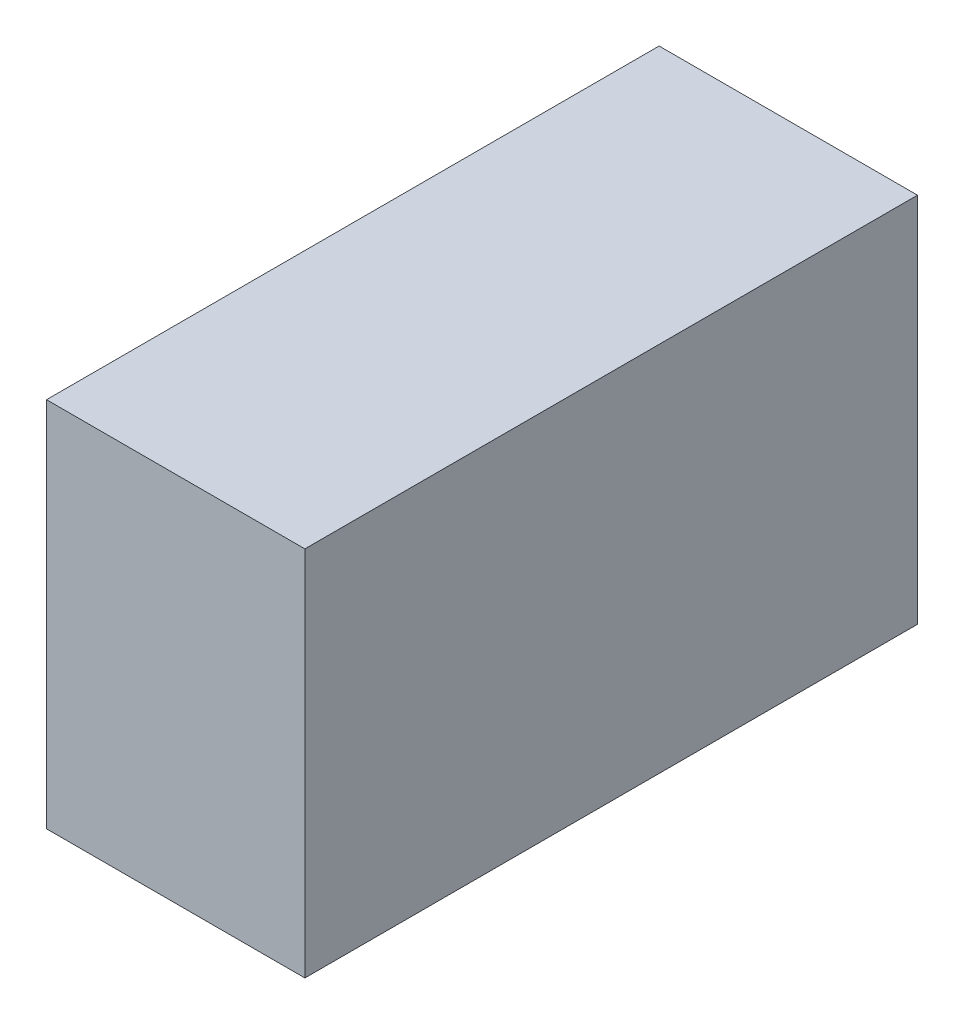
from build123d import *

# Parameters (mm, degrees)
SKETCH1_W           = 134.874
SKETCH1_H           = 319.786
BOSS_EXTRUDE1_DEPTH = 194


with BuildPart() as part:
    # Sketch1 → Boss-Extrude1 (new body)
    with BuildSketch(Plane(origin=(0, 0, 0), x_dir=(1, 0, 0), z_dir=(0, 1, 0))):
        with Locations((67.437, 159.893)):
            Rectangle(SKETCH1_W, SKETCH1_H)
    extrude(amount=BOSS_EXTRUDE1_DEPTH)


solid = part.part
